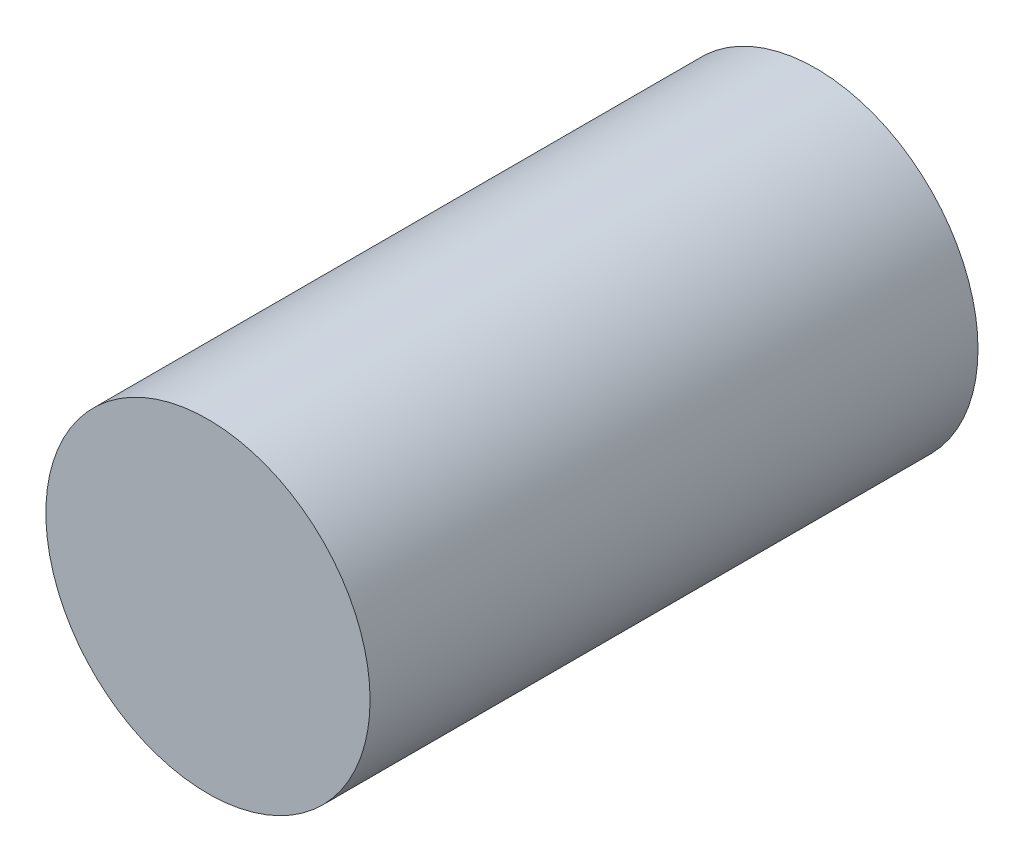
from build123d import *

# Parameters (mm, degrees)
SKETCH_1_W          = 432
SKETCH_1_H          = 330
EXTRUDE_1_DEPTH     = 12
SKETCH_2_OUTSIDE_W  = 542.75
SKETCH_2_OUTSIDE_H  = 440.75
SKETCH_2_OUTSIDE_R  = 3.2
CUT_EXTRUDE_1_DEPTH = 492.927840237


with BuildPart() as part:
    # 草图1 → 凸台-拉伸1 (new body)
    with BuildSketch(Plane.XY):
        with Locations((216, 70)):
            Rectangle(SKETCH_1_W, SKETCH_1_H)
    extrude(amount=EXTRUDE_1_DEPTH)

    # 草图2 outside → 切除-拉伸1 (cut, through all)
    with BuildSketch(Plane.XY.offset(12)):
        with Locations((216, 70)):
            Rectangle(SKETCH_2_OUTSIDE_W, SKETCH_2_OUTSIDE_H)
        with Locations((20, -42)):
            Circle(SKETCH_2_OUTSIDE_R, mode=Mode.SUBTRACT)
    extrude(amount=-CUT_EXTRUDE_1_DEPTH, mode=Mode.SUBTRACT)


solid = part.part
